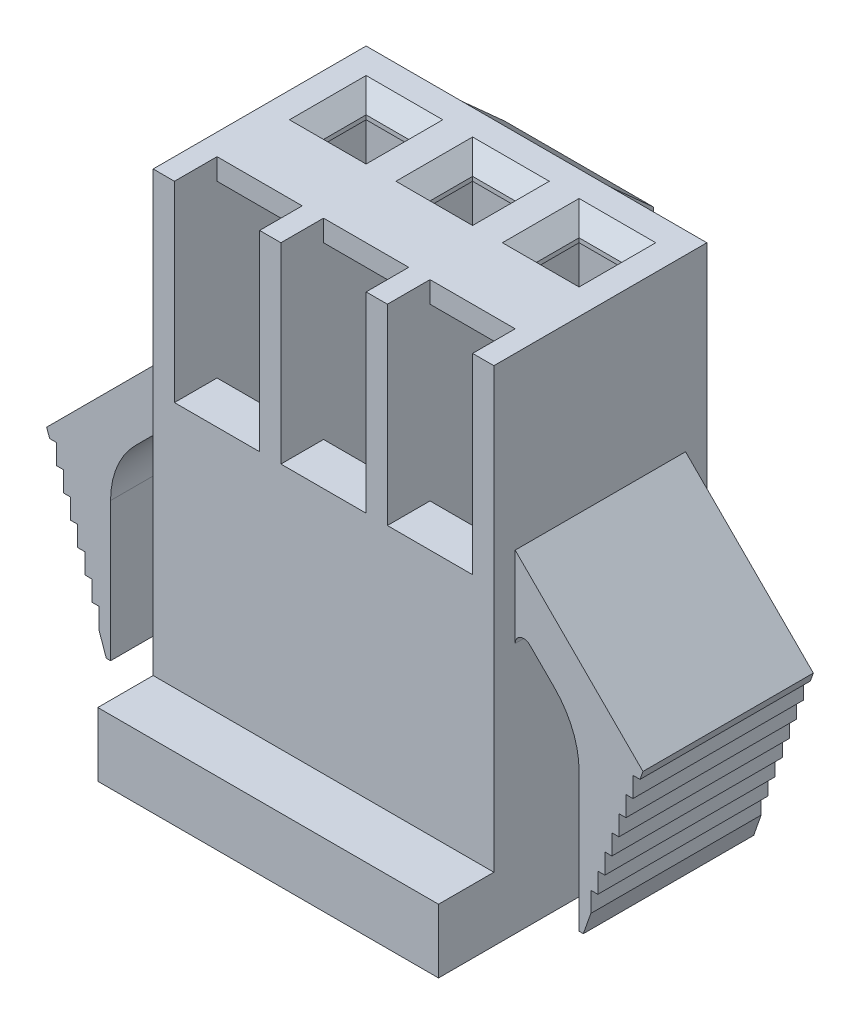
from build123d import *

# Parameters (mm, degrees)
SKIZZE1_W                       = 8
SKIZZE1_H                       = 11.8
AUFSATZ_LINEAR_AUSTRAGEN1_DEPTH = 2.5
SKIZZE2_W                       = 8
SKIZZE2_H                       = 1.5
AUFSATZ_LINEAR_AUSTRAGEN2_DEPTH = 1.3
SKIZZE3_W                       = 2.2
SKIZZE3_H                       = 1.5
AUFSATZ_LINEAR_AUSTRAGEN3_DEPTH = 1.2
AUFSATZ_LINEAR_AUSTRAGEN4_DEPTH = 1.75
AUFSATZ_LINEAR_AUSTRAGEN5_DEPTH = 0.05
SKIZZE6_W                       = 2
SKIZZE6_H                       = 3.5
SCHNITT_LINEAR_AUSTRAGEN1_DEPTH = 11.3
SKIZZE7_W                       = 2
SKIZZE7_H                       = 4.5
SCHNITT_LINEAR_AUSTRAGEN2_DEPTH = 1
SKIZZE8_W                       = 1
SKIZZE8_H                       = 1
SCHNITT_LINEAR_AUSTRAGEN3_DEPTH = 13.574975149
FASE1_SIZE                      = 0.4
LINEARES_MUSTER1_COUNT          = 3
LINEARES_MUSTER1_PITCH          = 2.5
FASE1_OF_LINEARES_MUSTER1_SIZE  = 0.4
AUFSATZ_LINEAR_AUSTRAGEN6_DEPTH = 2
SCHNITT_LINEAR_AUSTRAGEN4_DEPTH = 2.5
LINEARES_MUSTER2_COUNT          = 7
LINEARES_MUSTER2_PITCH          = 0.5
VERRUNDUNG1_R                   = 2
VERRUNDUNG2_R                   = 0.2
SPIEGELN1_COPY_1_DEPTH          = 2.5
SPIEGELN1_COPY_2_DEPTH          = 2.5
SPIEGELN1_COPY_3_DEPTH          = 2.5
SPIEGELN1_COPY_4_DEPTH          = 2.5
SPIEGELN1_COPY_5_DEPTH          = 2.5
SPIEGELN1_COPY_6_DEPTH          = 2.5
VERRUNDUNG1_OF_SPIEGELN1_R      = 2
VERRUNDUNG2_OF_SPIEGELN1_R      = 0.2


with BuildPart() as part:
    # Skizze1 → Aufsatz-Linear austragen1 (new, symmetric)
    with BuildSketch(Plane.XY):
        with Locations((0, 5.9)):
            Rectangle(SKIZZE1_W, SKIZZE1_H)
    extrude(amount=AUFSATZ_LINEAR_AUSTRAGEN1_DEPTH, both=True)

    # Skizze2 → Aufsatz-Linear austragen2 (add)
    with BuildSketch(Plane.XY.offset(2.5)):
        with Locations((0, 0.75)):
            Rectangle(SKIZZE2_W, SKIZZE2_H)
    extrude(amount=AUFSATZ_LINEAR_AUSTRAGEN2_DEPTH)

    # Skizze3 → Aufsatz-Linear austragen3 (add)
    with BuildSketch(Plane(origin=(0, 0, -2.5), x_dir=(-1, 0, 0), z_dir=(0, 0, -1))):
        with Locations((-2.9, 0.75)):
            Rectangle(SKIZZE3_W, SKIZZE3_H)
        with Locations((2.9, 0.75)):
            Rectangle(SKIZZE3_W, SKIZZE3_H)
    extrude(amount=AUFSATZ_LINEAR_AUSTRAGEN3_DEPTH)

    # Skizze4 → Aufsatz-Linear austragen4 (add, symmetric)
    with BuildSketch(Plane(origin=(0, 0, 0), x_dir=(0, 0, -1), z_dir=(1, 0, 0))):
        Polygon((2.5, 11.8), (3.5, 10.9), (3.5, 10.4), (2.5, 10.4), align=None)
    extrude(amount=AUFSATZ_LINEAR_AUSTRAGEN4_DEPTH, both=True)

    # Skizze5 → Aufsatz-Linear austragen5 (add)
    with BuildSketch(Plane(origin=(0, 0, -2.5), x_dir=(-1, 0, 0), z_dir=(0, 0, -1))):
        Polygon((1.8, 1.5), (2.9, 2.8), (4, 1.5), align=None)
    extrude(amount=AUFSATZ_LINEAR_AUSTRAGEN5_DEPTH)

    # Skizze6 → Schnitt-Linear austragen1 (cut)
    with BuildSketch(Plane.XZ):
        with Locations((-2.5, -0.25)):
            Rectangle(SKIZZE6_W, SKIZZE6_H)
    schnitt_linear_austragen1 = extrude(amount=-SCHNITT_LINEAR_AUSTRAGEN1_DEPTH, mode=Mode.SUBTRACT)

    # Skizze7 → Schnitt-Linear austragen2 (cut)
    with BuildSketch(Plane.XY.offset(2.5)):
        with Locations((-2.5, 9.55)):
            Rectangle(SKIZZE7_W, SKIZZE7_H)
    schnitt_linear_austragen2 = extrude(amount=-SCHNITT_LINEAR_AUSTRAGEN2_DEPTH, mode=Mode.SUBTRACT)

    # Skizze8 → Schnitt-Linear austragen3 (cut, through all)
    with BuildSketch(Plane.XZ.offset(-11.3)):
        with Locations((-2.5, -1)):
            Rectangle(SKIZZE8_W, SKIZZE8_H)
    schnitt_linear_austragen3 = extrude(amount=-SCHNITT_LINEAR_AUSTRAGEN3_DEPTH, mode=Mode.SUBTRACT)

    # Fase1
    fase1_edges = [part.edges().sort_by_distance(p)[0] for p in [
        (-3, 11.8, -1),
        (-2.5, 11.8, -0.5),
        (-2, 11.8, -1),
        (-2.5, 11.8, -1.5),
    ]]
    chamfer(fase1_edges, length=FASE1_SIZE)

    # Lineares Muster1: Schnitt-Linear austragen1, Schnitt-Linear austragen2, Schnitt-Linear austragen3 ×3
    with Locations(*[(i * LINEARES_MUSTER1_PITCH, 0, 0) for i in range(1, LINEARES_MUSTER1_COUNT)]):
        add(schnitt_linear_austragen1, mode=Mode.SUBTRACT)
        add(schnitt_linear_austragen2, mode=Mode.SUBTRACT)
        add(schnitt_linear_austragen3, mode=Mode.SUBTRACT)

    # Fase1 of Lineares Muster1
    fase1_of_lineares_muster1_edges = [part.edges().sort_by_distance(p)[0] for p in [
        (-0.5, 11.8, -1),
        (0, 11.8, -0.5),
        (0.5, 11.8, -1),
        (0, 11.8, -1.5),
        (2, 11.8, -1),
        (2.5, 11.8, -0.5),
        (3, 11.8, -1),
        (2.5, 11.8, -1.5),
    ]]
    chamfer(fase1_of_lineares_muster1_edges, length=FASE1_OF_LINEARES_MUSTER1_SIZE)

    # Skizze9 → Aufsatz-Linear austragen6 (add, symmetric)
    with BuildSketch(Plane.XY):
        Polygon((-4, 7.8), (-7, 4.8), (-5.6, 0.8), (-5.5, 0.8), (-5.5, 4.885786438), (-4, 6.385786438), align=None)
    aufsatz_linear_austragen6 = extrude(amount=AUFSATZ_LINEAR_AUSTRAGEN6_DEPTH, both=True)

    # Skizze11 → Schnitt-Linear austragen4 (cut, symmetric)
    with BuildSketch(Plane.XY):
        Polygon((-5.940175212, 1.771929178), (-5.775, 1.771929178), (-5.775, 1.3), align=None)
    schnitt_linear_austragen4 = extrude(amount=SCHNITT_LINEAR_AUSTRAGEN4_DEPTH, both=True, mode=Mode.SUBTRACT)

    # Lineares Muster2: Schnitt-Linear austragen4 ×7
    with Locations(*[Vector(-0.33035042472810877, 0.9438583563660166, 0) * (i * LINEARES_MUSTER2_PITCH) for i in range(1, LINEARES_MUSTER2_COUNT)]):
        add(schnitt_linear_austragen4, mode=Mode.SUBTRACT)

    # Verrundung1
    verrundung1_edges = [part.edges().sort_by_distance(p)[0] for p in [
        (-5.5, 4.885786438, 0),
    ]]
    fillet(verrundung1_edges, radius=VERRUNDUNG1_R)

    # Verrundung2
    verrundung2_edges = [part.edges().sort_by_distance(p)[0] for p in [
        (-4, 6.385786438, 0),
    ]]
    fillet(verrundung2_edges, radius=VERRUNDUNG2_R)

    # Spiegeln1: Aufsatz-Linear austragen6, Schnitt-Linear austragen4 across plane
    add(aufsatz_linear_austragen6.mirror(Plane(origin=(0, 0, 0), x_dir=(0, 0, 1), z_dir=(1, 0, 0))))
    add(schnitt_linear_austragen4.mirror(Plane(origin=(0, 0, 0), x_dir=(0, 0, 1), z_dir=(1, 0, 0))), mode=Mode.SUBTRACT)

    # Spiegeln1 copy 1 sketch → Spiegeln1 copy 1 (cut, symmetric)
    with BuildSketch(Plane(origin=(0.165175212, 0.471929178, 0), x_dir=(-1, 0, 0), z_dir=(0, 0, 1))):
        Polygon((-5.940175212, -1.771929178), (-5.775, -1.771929178), (-5.775, -1.3), align=None)
    extrude(amount=SPIEGELN1_COPY_1_DEPTH, both=True, mode=Mode.SUBTRACT)

    # Spiegeln1 copy 2 sketch → Spiegeln1 copy 2 (cut, symmetric)
    with BuildSketch(Plane(origin=(0.33035042472810877, 0.9438583563660166, 0), x_dir=(-1, 0, 0), z_dir=(0, 0, 1))):
        Polygon((-5.940175212, -1.771929178), (-5.775, -1.771929178), (-5.775, -1.3), align=None)
    extrude(amount=SPIEGELN1_COPY_2_DEPTH, both=True, mode=Mode.SUBTRACT)

    # Spiegeln1 copy 3 sketch → Spiegeln1 copy 3 (cut, symmetric)
    with BuildSketch(Plane(origin=(0.495525637, 1.415787535, 0), x_dir=(-1, 0, 0), z_dir=(0, 0, 1))):
        Polygon((-5.940175212, -1.771929178), (-5.775, -1.771929178), (-5.775, -1.3), align=None)
    extrude(amount=SPIEGELN1_COPY_3_DEPTH, both=True, mode=Mode.SUBTRACT)

    # Spiegeln1 copy 4 sketch → Spiegeln1 copy 4 (cut, symmetric)
    with BuildSketch(Plane(origin=(0.660700849, 1.887716713, 0), x_dir=(-1, 0, 0), z_dir=(0, 0, 1))):
        Polygon((-5.940175212, -1.771929178), (-5.775, -1.771929178), (-5.775, -1.3), align=None)
    extrude(amount=SPIEGELN1_COPY_4_DEPTH, both=True, mode=Mode.SUBTRACT)

    # Spiegeln1 copy 5 sketch → Spiegeln1 copy 5 (cut, symmetric)
    with BuildSketch(Plane(origin=(0.825876062, 2.359645891, 0), x_dir=(-1, 0, 0), z_dir=(0, 0, 1))):
        Polygon((-5.940175212, -1.771929178), (-5.775, -1.771929178), (-5.775, -1.3), align=None)
    extrude(amount=SPIEGELN1_COPY_5_DEPTH, both=True, mode=Mode.SUBTRACT)

    # Spiegeln1 copy 6 sketch → Spiegeln1 copy 6 (cut, symmetric)
    with BuildSketch(Plane(origin=(0.991051274, 2.831575069, 0), x_dir=(-1, 0, 0), z_dir=(0, 0, 1))):
        Polygon((-5.940175212, -1.771929178), (-5.775, -1.771929178), (-5.775, -1.3), align=None)
    extrude(amount=SPIEGELN1_COPY_6_DEPTH, both=True, mode=Mode.SUBTRACT)

    # Verrundung1 of Spiegeln1
    verrundung1_of_spiegeln1_edges = [part.edges().sort_by_distance(p)[0] for p in [
        (5.5, 4.885786438, 0),
    ]]
    fillet(verrundung1_of_spiegeln1_edges, radius=VERRUNDUNG1_OF_SPIEGELN1_R)

    # Verrundung2 of Spiegeln1
    verrundung2_of_spiegeln1_edges = [part.edges().sort_by_distance(p)[0] for p in [
        (4, 6.385786438, 0),
    ]]
    fillet(verrundung2_of_spiegeln1_edges, radius=VERRUNDUNG2_OF_SPIEGELN1_R)


solid = part.part
